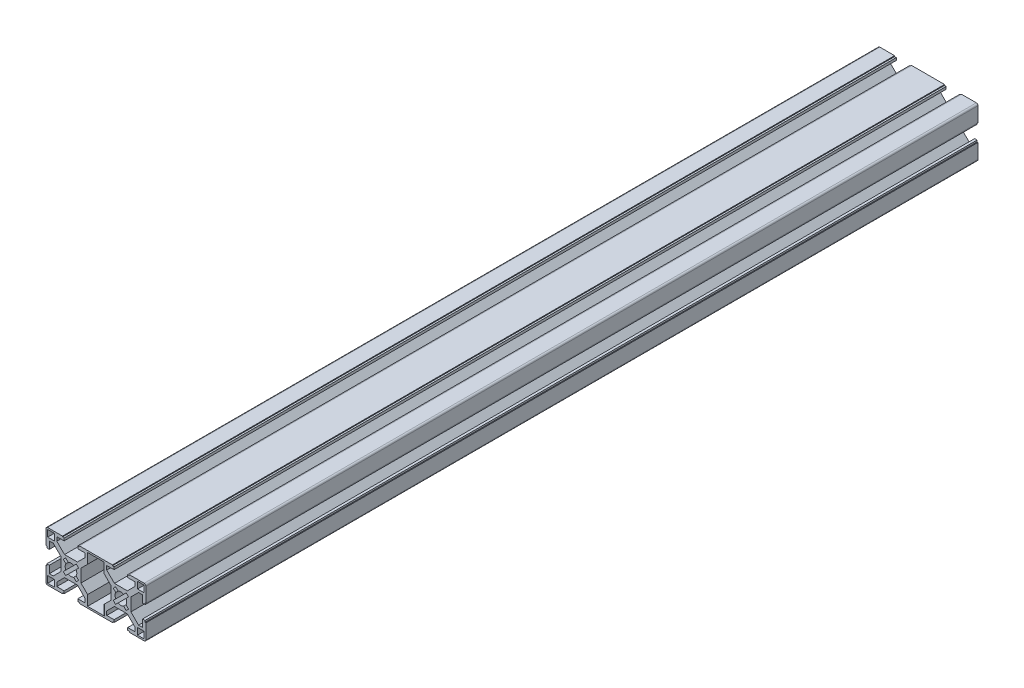
from build123d import *

# Parameters (mm, degrees)
ESBO_O1_W                      = 4
ESBO_O1_H                      = 4
RESSALTO_EXTRUS_O1_DEPTH       = 500
PADR_OCIRCULAR1_COUNT          = 4
PADR_O_LINEAR1_COUNT           = 2
PADR_O_LINEAR1_PITCH           = 30
PADR_O_LINEAR1_COPY_1_SKETCH_W = 4
PADR_O_LINEAR1_COPY_1_SKETCH_H = 4
PADR_O_LINEAR1_COPY_1_DEPTH    = 500
PADR_O_LINEAR1_COPY_2_SKETCH_W = 4
PADR_O_LINEAR1_COPY_2_SKETCH_H = 4
PADR_O_LINEAR1_COPY_2_DEPTH    = 500
PADR_O_LINEAR1_COPY_3_SKETCH_W = 4
PADR_O_LINEAR1_COPY_3_SKETCH_H = 4
PADR_O_LINEAR1_COPY_3_DEPTH    = 500
ESBO_O4_W                      = 10
ESBO_O4_H                      = 28
CORTE_EXTRUS_O1_DEPTH          = 503.244960154
FILETE1_R                      = 1


with BuildPart() as part:
    # Esboço1 → Ressalto-extrusão1 (new body)
    with BuildSketch(Plane.XY):
        with BuildLine():
            ThreePointArc((-1.664601464, 3.078815026), (-0.858529967, 3.393070335), (0, 3.5))
            Line((0, 3.5), (0, 6))
            Line((0, 6), (-3.878679656, 6))
            Line((-3.878679656, 6), (-8.5, 10.621320344))
            Line((-8.5, 10.621320344), (-8.5, 13))
            Line((-8.5, 13), (-4.1, 13))
            Line((-4.1, 13), (-4.1, 14.5))
            Line((-4.1, 14.5), (-5.1, 14.5))
            Line((-5.1, 14.5), (-5.1, 15))
            Line((-5.1, 15), (-15, 15))
            Line((-15, 15), (-15, 5.1))
            Line((-15, 5.1), (-14.5, 5.1))
            Line((-14.5, 5.1), (-14.5, 4.1))
            Line((-14.5, 4.1), (-13, 4.1))
            Line((-13, 4.1), (-13, 8.5))
            Line((-13, 8.5), (-10.621320344, 8.5))
            Line((-10.621320344, 8.5), (-6, 3.878679656))
            Line((-6, 3.878679656), (-6, 0))
            Line((-6, 0), (-3.5, 0))
            ThreePointArc((-3.5, 0), (-3.393070335, 0.858529967), (-3.078815026, 1.664601464))
            Line((-3.078815026, 1.664601464), (-4.596194078, 3.181980515))
            Line((-4.596194078, 3.181980515), (-3.181980515, 4.596194078))
            Line((-3.181980515, 4.596194078), (-1.664601464, 3.078815026))
        make_face()
        with Locations((-12, 12)):
            Rectangle(ESBO_O1_W, ESBO_O1_H, mode=Mode.SUBTRACT)
    ressalto_extrus_o1 = extrude(amount=RESSALTO_EXTRUS_O1_DEPTH)

    # PadrãoCircular1: Ressalto-extrusão1 ×4 about axis
    padr_ocircular1_axis = Axis((0, 0, 0), (0, 0, 1))
    for i in range(1, PADR_OCIRCULAR1_COUNT):
        add(ressalto_extrus_o1.rotate(padr_ocircular1_axis, i * 360 / PADR_OCIRCULAR1_COUNT))

    # Padrão linear1: Ressalto-extrusão1 ×2
    with Locations(*[(i * PADR_O_LINEAR1_PITCH, 0, 0) for i in range(1, PADR_O_LINEAR1_COUNT)]):
        add(ressalto_extrus_o1)

    # Padrão linear1 copy 1 sketch → Padrão linear1 copy 1 (add)
    with BuildSketch(Plane(origin=(30, 0, 0), x_dir=(0, 1, 0), z_dir=(0, 0, 1))):
        with BuildLine():
            ThreePointArc((-1.664601464, 3.078815026), (-0.858529967, 3.393070335), (0, 3.5))
            Line((0, 3.5), (0, 6))
            Line((0, 6), (-3.878679656, 6))
            Line((-3.878679656, 6), (-8.5, 10.621320344))
            Line((-8.5, 10.621320344), (-8.5, 13))
            Line((-8.5, 13), (-4.1, 13))
            Line((-4.1, 13), (-4.1, 14.5))
            Line((-4.1, 14.5), (-5.1, 14.5))
            Line((-5.1, 14.5), (-5.1, 15))
            Line((-5.1, 15), (-15, 15))
            Line((-15, 15), (-15, 5.1))
            Line((-15, 5.1), (-14.5, 5.1))
            Line((-14.5, 5.1), (-14.5, 4.1))
            Line((-14.5, 4.1), (-13, 4.1))
            Line((-13, 4.1), (-13, 8.5))
            Line((-13, 8.5), (-10.621320344, 8.5))
            Line((-10.621320344, 8.5), (-6, 3.878679656))
            Line((-6, 3.878679656), (-6, 0))
            Line((-6, 0), (-3.5, 0))
            ThreePointArc((-3.5, 0), (-3.393070335, 0.858529967), (-3.078815026, 1.664601464))
            Line((-3.078815026, 1.664601464), (-4.596194078, 3.181980515))
            Line((-4.596194078, 3.181980515), (-3.181980515, 4.596194078))
            Line((-3.181980515, 4.596194078), (-1.664601464, 3.078815026))
        make_face()
        with Locations((-12, 12)):
            Rectangle(PADR_O_LINEAR1_COPY_1_SKETCH_W, PADR_O_LINEAR1_COPY_1_SKETCH_H, mode=Mode.SUBTRACT)
    extrude(amount=PADR_O_LINEAR1_COPY_1_DEPTH)

    # Padrão linear1 copy 2 sketch → Padrão linear1 copy 2 (add)
    with BuildSketch(Plane(origin=(30, 0, 0), x_dir=(-1, 0, 0), z_dir=(0, 0, 1))):
        with BuildLine():
            ThreePointArc((-1.664601464, 3.078815026), (-0.858529967, 3.393070335), (0, 3.5))
            Line((0, 3.5), (0, 6))
            Line((0, 6), (-3.878679656, 6))
            Line((-3.878679656, 6), (-8.5, 10.621320344))
            Line((-8.5, 10.621320344), (-8.5, 13))
            Line((-8.5, 13), (-4.1, 13))
            Line((-4.1, 13), (-4.1, 14.5))
            Line((-4.1, 14.5), (-5.1, 14.5))
            Line((-5.1, 14.5), (-5.1, 15))
            Line((-5.1, 15), (-15, 15))
            Line((-15, 15), (-15, 5.1))
            Line((-15, 5.1), (-14.5, 5.1))
            Line((-14.5, 5.1), (-14.5, 4.1))
            Line((-14.5, 4.1), (-13, 4.1))
            Line((-13, 4.1), (-13, 8.5))
            Line((-13, 8.5), (-10.621320344, 8.5))
            Line((-10.621320344, 8.5), (-6, 3.878679656))
            Line((-6, 3.878679656), (-6, 0))
            Line((-6, 0), (-3.5, 0))
            ThreePointArc((-3.5, 0), (-3.393070335, 0.858529967), (-3.078815026, 1.664601464))
            Line((-3.078815026, 1.664601464), (-4.596194078, 3.181980515))
            Line((-4.596194078, 3.181980515), (-3.181980515, 4.596194078))
            Line((-3.181980515, 4.596194078), (-1.664601464, 3.078815026))
        make_face()
        with Locations((-12, 12)):
            Rectangle(PADR_O_LINEAR1_COPY_2_SKETCH_W, PADR_O_LINEAR1_COPY_2_SKETCH_H, mode=Mode.SUBTRACT)
    extrude(amount=PADR_O_LINEAR1_COPY_2_DEPTH)

    # Padrão linear1 copy 3 sketch → Padrão linear1 copy 3 (add)
    with BuildSketch(Plane(origin=(30, 0, 0), x_dir=(0, -1, 0), z_dir=(0, 0, 1))):
        with BuildLine():
            ThreePointArc((-1.664601464, 3.078815026), (-0.858529967, 3.393070335), (0, 3.5))
            Line((0, 3.5), (0, 6))
            Line((0, 6), (-3.878679656, 6))
            Line((-3.878679656, 6), (-8.5, 10.621320344))
            Line((-8.5, 10.621320344), (-8.5, 13))
            Line((-8.5, 13), (-4.1, 13))
            Line((-4.1, 13), (-4.1, 14.5))
            Line((-4.1, 14.5), (-5.1, 14.5))
            Line((-5.1, 14.5), (-5.1, 15))
            Line((-5.1, 15), (-15, 15))
            Line((-15, 15), (-15, 5.1))
            Line((-15, 5.1), (-14.5, 5.1))
            Line((-14.5, 5.1), (-14.5, 4.1))
            Line((-14.5, 4.1), (-13, 4.1))
            Line((-13, 4.1), (-13, 8.5))
            Line((-13, 8.5), (-10.621320344, 8.5))
            Line((-10.621320344, 8.5), (-6, 3.878679656))
            Line((-6, 3.878679656), (-6, 0))
            Line((-6, 0), (-3.5, 0))
            ThreePointArc((-3.5, 0), (-3.393070335, 0.858529967), (-3.078815026, 1.664601464))
            Line((-3.078815026, 1.664601464), (-4.596194078, 3.181980515))
            Line((-4.596194078, 3.181980515), (-3.181980515, 4.596194078))
            Line((-3.181980515, 4.596194078), (-1.664601464, 3.078815026))
        make_face()
        with Locations((-12, 12)):
            Rectangle(PADR_O_LINEAR1_COPY_3_SKETCH_W, PADR_O_LINEAR1_COPY_3_SKETCH_H, mode=Mode.SUBTRACT)
    extrude(amount=PADR_O_LINEAR1_COPY_3_DEPTH)

    # Esboço4 → Corte-extrusão1 (cut, through all)
    with BuildSketch(Plane(origin=(0, 0, 0), x_dir=(-1, 0, 0), z_dir=(0, 0, -1))):
        with Locations((-15, 0)):
            Rectangle(ESBO_O4_W, ESBO_O4_H)
    extrude(amount=-CORTE_EXTRUS_O1_DEPTH, mode=Mode.SUBTRACT)

    # Filete1
    filete1_edges = [part.edges().sort_by_distance(p)[0] for p in [
        (45, -15, 250),
        (45, 15, 250),
        (-15, 15, 250),
        (-15, -15, 250),
    ]]
    fillet(filete1_edges, radius=FILETE1_R)


solid = part.part
